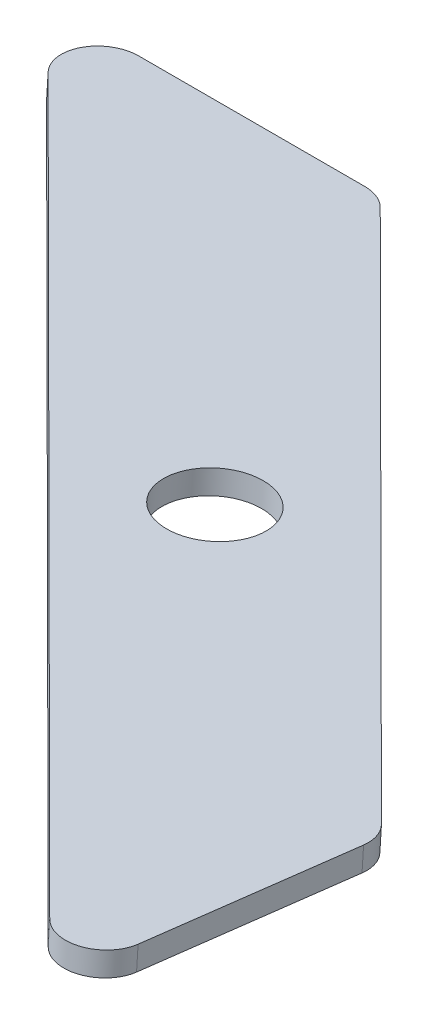
from build123d import *

# Parameters (mm, degrees)
SKETCH1_R           = 3.2639
BOSS_EXTRUDE1_DEPTH = 1.5875
FILLET1_R           = 2.54


with BuildPart() as part:
    # Sketch1 → Boss-Extrude1 (new body)
    with BuildSketch(Plane(origin=(0, 40.718386742, -2.659285129), x_dir=(-1, 0, 0), z_dir=(4.5722974018058706e-14, -0.9978741525202127, 0.06517035930595697))):
        Polygon((-197.904995268, -962.046394088), (-157.684111673, -921.825510494), (-135.233471371, -921.825510494), (-196.612587776, -983.204626899), align=None)
        with Locations((-171.858791522, -947.225510494)):
            Circle(SKETCH1_R, mode=Mode.SUBTRACT)
    extrude(amount=BOSS_EXTRUDE1_DEPTH)

    # Fillet1
    fillet1_edges = [part.edges().sort_by_distance(p)[0] for p in [
        (197.904995268, 102.623233305, 957.39367403),
        (157.684111673, 100.002023869, 917.258293899),
        (135.233471371, 100.002023869, 917.258293899),
        (196.612587776, 104.002122939, 978.506927665),
    ]]
    fillet(fillet1_edges, radius=FILLET1_R)


solid = part.part
